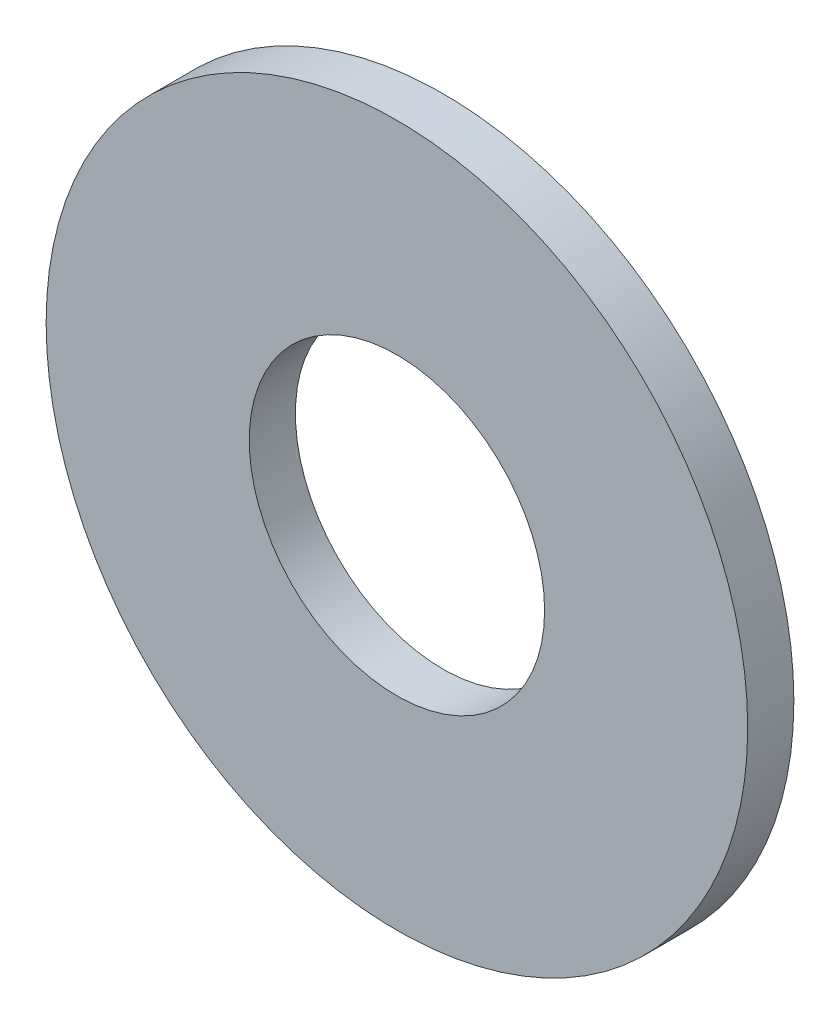
from build123d import *

# Parameters (mm, degrees)
SKETCH1_R           = 4.826
SKETCH1_R_2         = 2.032
BOSS_EXTRUDE1_DEPTH = 0.635


with BuildPart() as part:
    # Sketch1 → Boss-Extrude1 (new body)
    with BuildSketch(Plane.XY):
        with Locations((2558.082507729, 2698.686786983)):
            Circle(SKETCH1_R)
        with Locations((2558.082507729, 2698.686786983)):
            Circle(SKETCH1_R_2, mode=Mode.SUBTRACT)
    extrude(amount=BOSS_EXTRUDE1_DEPTH)


solid = part.part
